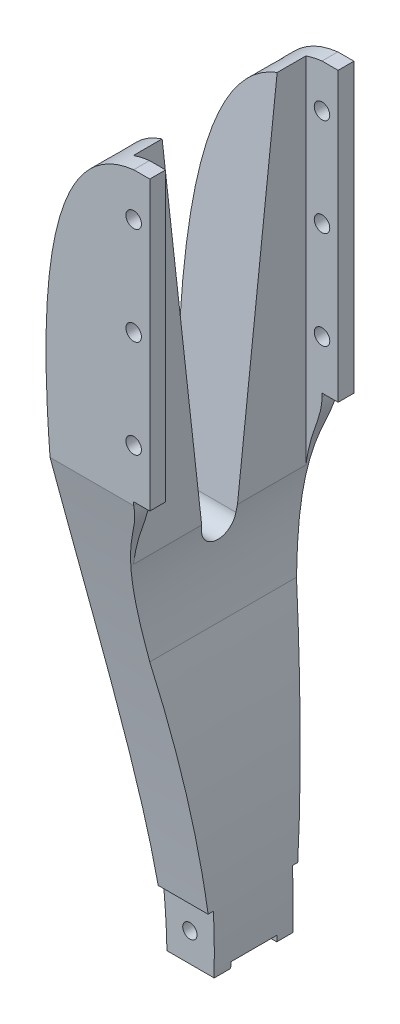
from build123d import *

# Parameters (mm, degrees)
BOSS_EXTRUDE2_DEPTH        = 35.5
CUT_EXTRUDE1_DEPTH         = 17.75
CUT_EXTRUDE2_DEPTH         = 2.8
SKETCH5_W                  = 2.8
SKETCH5_H                  = 2.75
BOSS_EXTRUDE3_DEPTH        = 50
CUT_EXTRUDE3_DEPTH         = 15
F_2_7_2_7_DIAMETER_HOLE1_D = 2.7
M3_TAPPED_HOLE1_D          = 2.5
CUT_EXTRUDE4_DEPTH         = 126.902937834
CUT_EXTRUDE4_DEPTH_BACK    = 126.902937834
SKETCH12_W                 = 1.496855304
SKETCH12_H                 = 10
SKETCH12_W_2               = 1.571931937
CUT_EXTRUDE5_DEPTH         = 20
CUT_EXTRUDE6_DEPTH         = 1


with BuildPart() as part:
    # Sketch1 → Boss-Extrude2 (new body)
    with BuildSketch(Plane.XY):
        with BuildLine():
            Line((5.6, 35.6), (5.6, -15))
            add(Edge.make_bspline(
                [(5.6, -15), (5.6, -17.274393969), (1.604195195, -25.847964508), (2.415841027, -35.113621235), (3.409417942, -42.11611418)],
                knots=[0, 0, 0, 0, 0.227789152, 0.921500182, 0.921500182, 0.921500182, 0.921500182], degree=3))
            add(Edge.make_bspline(
                [(3.409417942, -42.11611418), (14.021423643, -91.198515752), (3.540705721, -122.805120936)],
                knots=[0, 0, 0, 1, 1, 1], degree=2))
            Line((3.540705721, -122.805120936), (-4.088116427, -120.408076375))
            add(Edge.make_bspline(
                [(5.6, 35.6), (-12.367874994, 33.521263174), (-8.7823866, -50.782642202), (5.954211422, -91.451497422), (-4.088116427, -120.408076375)],
                knots=[0, 0, 0, 0, 0.40530679, 1, 1, 1, 1], degree=3))
        make_face()
    extrude(amount=BOSS_EXTRUDE2_DEPTH)

    # Sketch3 → Cut-Extrude1 (cut, symmetric)
    with BuildSketch(Plane(origin=(0, 0, 0), x_dir=(0, 0, -1), z_dir=(1, 0, 0))):
        with BuildLine():
            Line((0, -14.98237842), (29.62736343, -14.98237842))
            Line((29.62736343, -14.98237842), (29.62736343, -131.572481325))
            Line((29.62736343, -131.572481325), (-60.547074518, -131.572481325))
            Line((-60.547074518, -131.572481325), (-60.547074518, -14.98237842))
            Line((-60.547074518, -14.98237842), (-35.5, -14.98237842))
            add(Edge.make_bspline(
                [(-35.5, -14.98237842), (-28.308780975, -49.75857776), (-24.077993602, -85.166412163), (-22.769212626, -120.408076375)],
                knots=[0, 0, 0, 0, 1, 1, 1, 1], degree=3))
            Line((-22.769212626, -120.408076375), (-12.75, -120.408076375))
            add(Edge.make_bspline(
                [(0, -14.98237842), (-7.191219025, -49.75857776), (-11.441219025, -85.166412163), (-12.75, -120.408076375)],
                knots=[0, 0, 0, 0, 1, 1, 1, 1], degree=3))
        make_face()
    extrude(amount=CUT_EXTRUDE1_DEPTH, both=True, mode=Mode.SUBTRACT)

    # Sketch4 → Cut-Extrude2 (cut)
    with BuildSketch(Plane(origin=(5.6, 0, 0), x_dir=(0, 0, -1), z_dir=(1, 0, 0))):
        Polygon((-2.75, 35.6), (-32.75, 35.6), (-32.75, -15.000000007), (-32.75, -32.018147114), (-2.75, -32.018147114), (-2.75, -15.000000007), align=None)
    extrude(amount=-CUT_EXTRUDE2_DEPTH, mode=Mode.SUBTRACT)

    # Sketch5 → Boss-Extrude3 (add)
    with BuildSketch(Plane(origin=(0, 35.6, 0), x_dir=(1, 0, 0), z_dir=(0, 1, 0))):
        with Locations((7, -1.375)):
            Rectangle(SKETCH5_W, SKETCH5_H)
        with Locations((7, -34.125)):
            Rectangle(SKETCH5_W, SKETCH5_H)
    extrude(amount=-BOSS_EXTRUDE3_DEPTH)

    # Sketch6 → Cut-Extrude3 (cut, symmetric)
    with BuildSketch(Plane(origin=(0, 0, 0), x_dir=(0, 0, -1), z_dir=(1, 0, 0))):
        with BuildLine():
            Line((-7.75, 34.96933844), (-14.781773193, -27.808788024))
            ThreePointArc((-14.781773193, -27.808788024), (-17.763748777, -30.474846509), (-20.744622729, -27.807556366))
            Line((-20.744622729, -27.807556366), (-27.75, 34.96933844))
            Line((-27.75, 34.96933844), (-7.75, 34.96933844))
        make_face()
    extrude(amount=CUT_EXTRUDE3_DEPTH, both=True, mode=Mode.SUBTRACT)

    # Ø2.7 (2.7) Diameter Hole1 (through all)
    with Locations(Plane.XY.offset(35.5)):
        with Locations((5.6, 28.1), (5.6, 11.1), (5.6, -5.9)):
            Hole(F_2_7_2_7_DIAMETER_HOLE1_D / 2)

    # M3 Tapped Hole1 (through all)
    with Locations(Plane.XY.offset(35.5)):
        with Locations((4.5, -85)):
            Hole(M3_TAPPED_HOLE1_D / 2)

    # Sketch12 → Cut-Extrude4 (cut, two sides: drawn at the far end of the back side and taken through both)
    with BuildSketch(Plane(origin=(0, 0, 0), x_dir=(0, 0, -1), z_dir=(1, 0, 0)).offset(-CUT_EXTRUDE4_DEPTH_BACK)):
        with Locations((-10.144277768, -85)):
            Rectangle(SKETCH12_W, SKETCH12_H)
        with Locations((-25.408624424, -85)):
            Rectangle(SKETCH12_W_2, SKETCH12_H)
    extrude(amount=CUT_EXTRUDE4_DEPTH + CUT_EXTRUDE4_DEPTH_BACK, mode=Mode.SUBTRACT)

    # Sketch14 → Cut-Extrude5 (cut)
    with BuildSketch(Plane(origin=(0, 0, 10.89270542), x_dir=(-1, 0, 0), z_dir=(0, 0, -1))):
        Polygon((-8.720315384, -90), (6.272671273, -90), (6.272671273, -124.093634091), (-10.541100015, -124.093634091), (-10.541100015, -90), align=None)
    extrude(amount=-CUT_EXTRUDE5_DEPTH, mode=Mode.SUBTRACT)

    # Sketch15 → Cut-Extrude6 (cut)
    with BuildSketch(Plane(origin=(0, -90, 0), x_dir=(-1, 0, 0), z_dir=(0, -1, 0))):
        with BuildLine():
            Line((-5.220315384, -13.74270542), (-8.720315384, -13.74270542))
            Line((-8.720315384, -13.74270542), (-9.623354914, -13.74270542))
            Line((-9.623354914, -13.74270542), (-9.623354914, -21.74270542))
            Line((-9.623354914, -21.74270542), (-5.220315384, -21.74270542))
            ThreePointArc((-5.220315384, -21.74270542), (-1.220315384, -17.74270542), (-5.220315384, -13.74270542))
        make_face()
    extrude(amount=-CUT_EXTRUDE6_DEPTH, mode=Mode.SUBTRACT)


solid = part.part
